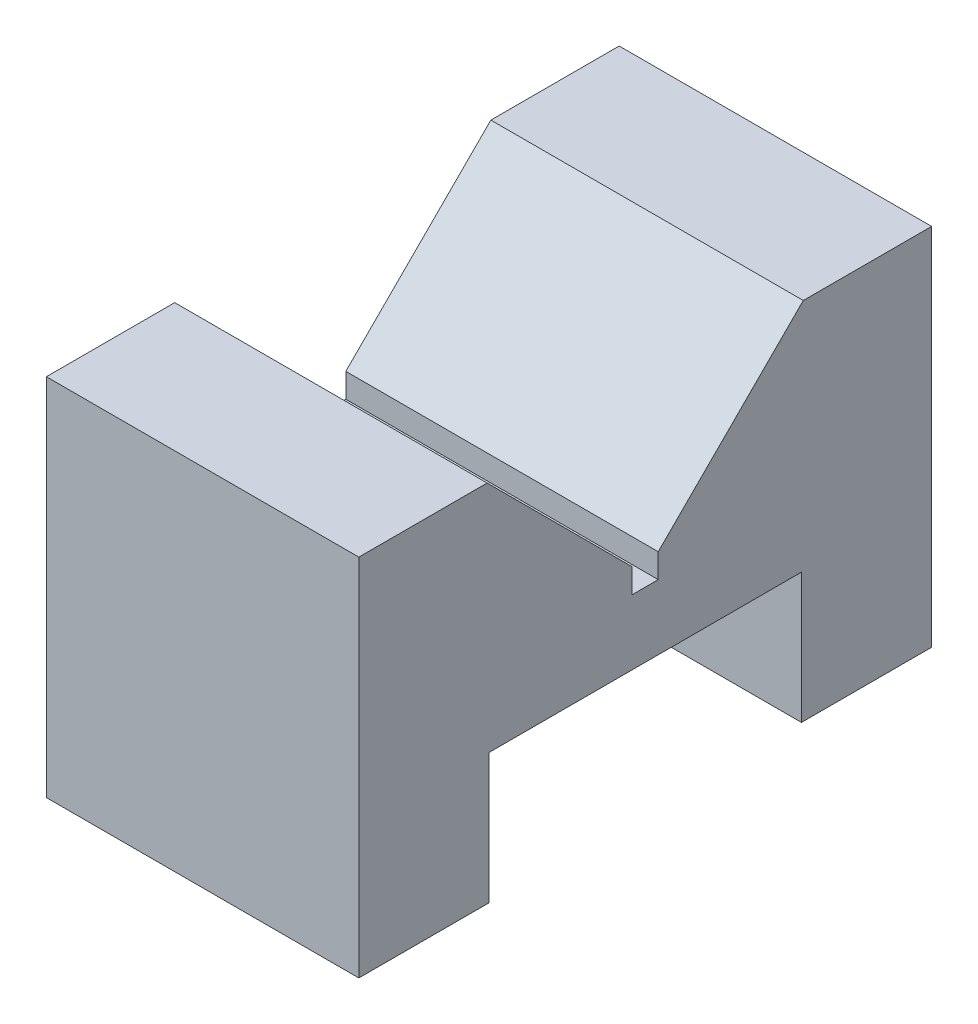
from build123d import *

# Parameters (mm, degrees)
BOSS_EXTRUDE1_DEPTH   = 24
M5_TAPPED_HOLE1_D     = 4.2
M5_TAPPED_HOLE1_DEPTH = 12
M5_TAPPED_HOLE1_TIP   = 1.2618073


with BuildPart() as part:
    # Sketch1 → Boss-Extrude1 (new body)
    with BuildSketch(Plane(origin=(0, 0, 0), x_dir=(0, 0, -1), z_dir=(1, 0, 0))):
        Polygon((12, 10), (-12, 10), (-12, 0), (-22, 0), (-22, 28), (-12.142135624, 28), (-1, 16.857864376), (-1, 15), (1, 15), (1, 16.857864376), (12.142135624, 28), (22, 28), (22, 0), (12, 0), align=None)
    extrude(amount=BOSS_EXTRUDE1_DEPTH)

    # M5 Tapped Hole1
    with Locations(Plane(origin=(0, 0, 0), x_dir=(-1, 0, 0), z_dir=(0, -1, 0))):
        with Locations((-13, 17), (-13, -17)):
            Hole(M5_TAPPED_HOLE1_D / 2, depth=M5_TAPPED_HOLE1_DEPTH)
            with Locations((0, 0, -(M5_TAPPED_HOLE1_DEPTH + M5_TAPPED_HOLE1_TIP / 2))):  # 118° drill point
                Cone(0, M5_TAPPED_HOLE1_D / 2, M5_TAPPED_HOLE1_TIP, mode=Mode.SUBTRACT)


solid = part.part
